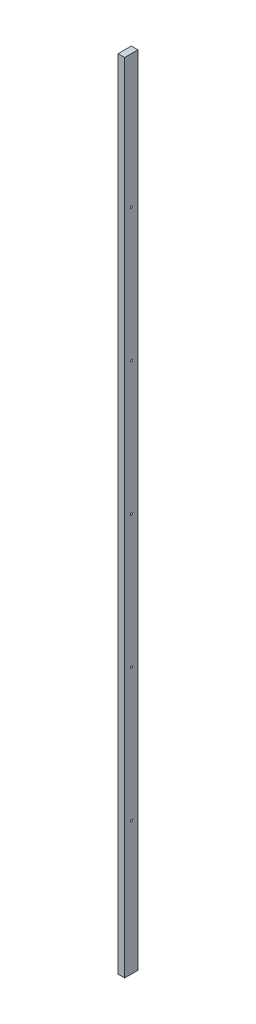
from build123d import *

# Parameters (mm, degrees)
SKETCH_1_W          = 25
SKETCH_1_H          = 50
EXTRUDE_1_DEPTH     = 3000
SKETCH_2_R          = 4
CUT_EXTRUDE_1_DEPTH = 3000


with BuildPart() as part:
    # Эскиз1 → Бобышка-Вытянуть1 (new body)
    with BuildSketch(Plane(origin=(0, 0, 0), x_dir=(1, 0, 0), z_dir=(0, 1, 0))):
        Rectangle(SKETCH_1_W, SKETCH_1_H)
    extrude(amount=EXTRUDE_1_DEPTH)

    # Эскиз2 → Вырез-Вытянуть1 (cut)
    with BuildSketch(Plane(origin=(12.5, 0, 0), x_dir=(0, 0, -1), z_dir=(1, 0, 0))):
        with Locations((0, 2500)):
            Circle(SKETCH_2_R)
        with Locations((0, 2000)):
            Circle(SKETCH_2_R)
        with Locations((0, 1500)):
            Circle(SKETCH_2_R)
        with Locations((0, 1000)):
            Circle(SKETCH_2_R)
        with Locations((0, 500)):
            Circle(SKETCH_2_R)
    extrude(amount=-CUT_EXTRUDE_1_DEPTH, mode=Mode.SUBTRACT)


solid = part.part
